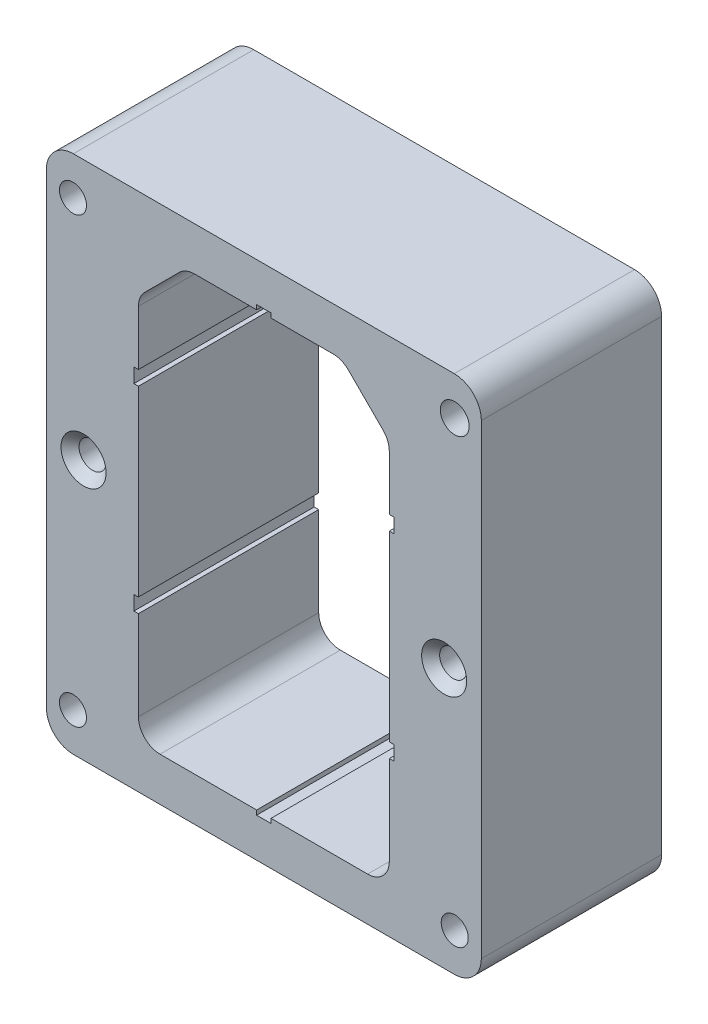
from build123d import *

# Parameters (mm, degrees)
SZKIC1_R                    = 1.5
SZKIC1_R_2                  = 1.6
DODANIE_WYCI_GNI_CIE1_DEPTH = 20
ZAOKR_GLENIE1_R             = 3
SFAZOWANIE1_SIZE            = 1
SZKIC2_R                    = 1.5
SZKIC2_R_2                  = 1.6
DODANIE_WYCI_GNI_CIE2_DEPTH = 0.2


with BuildPart() as part:
    # Szkic1 → Dodanie-wyciągnięcie1 (new body)
    with BuildSketch(Plane.XY):
        Polygon((-39.009773604, 35.733555733), (-39.009773604, 39.983555733), (9.235464557, 39.983555733), (9.235464557, 35.733555733), (9.235464557, -13.466444267), (9.235464557, -17.716444267), (-39.009773604, -17.716444267), (-39.009773604, -13.466444267), align=None)
        with Locations((5.112845476, 11.133555733)):
            Circle(SZKIC1_R, mode=Mode.SUBTRACT)
        with Locations((-34.887154524, 11.133555733)):
            Circle(SZKIC1_R, mode=Mode.SUBTRACT)
        with Locations((6.285464557, -13.466444267)):
            Circle(SZKIC1_R, mode=Mode.SUBTRACT)
        with Locations((6.285464557, 35.733555733)):
            Circle(SZKIC1_R_2, mode=Mode.SUBTRACT)
        with Locations((-36.059773604, 35.733555733)):
            Circle(SZKIC1_R, mode=Mode.SUBTRACT)
        with Locations((-36.059773604, -13.466444267)):
            Circle(SZKIC1_R, mode=Mode.SUBTRACT)
        with BuildLine():
            Line((-14.087154524, -13.391444267), (-14.087154524, -12.891444267))
            Line((-14.087154524, -12.891444267), (-3.372154524, -12.891444267))
            ThreePointArc((-3.372154524, -12.891444267), (-1.675098249, -12.188500541), (-0.972154524, -10.491444267))
            Line((-0.972154524, -10.491444267), (-0.972154524, -0.591444267))
            Line((-0.972154524, -0.591444267), (-0.472154524, -0.591444267))
            Line((-0.472154524, -0.591444267), (-0.472154524, 1.008555733))
            Line((-0.472154524, 1.008555733), (-0.972154524, 1.008555733))
            Line((-0.972154524, 1.008555733), (-0.972154524, 21.258555733))
            Line((-0.972154524, 21.258555733), (-0.472154524, 21.258555733))
            Line((-0.472154524, 21.258555733), (-0.472154524, 22.858555733))
            Line((-0.472154524, 22.858555733), (-0.972154524, 22.858555733))
            Line((-0.972154524, 22.858555733), (-0.972154524, 28.930128609))
            ThreePointArc((-0.972154524, 28.930128609), (-1.154843646, 29.848568846), (-1.675098249, 30.627184884))
            Line((-1.675098249, 30.627184884), (-5.503525374, 34.455612008))
            ThreePointArc((-5.503525374, 34.455612008), (-6.282141411, 34.975866612), (-7.200581648, 35.158555733))
            Line((-7.200581648, 35.158555733), (-14.087154524, 35.158555733))
            Line((-14.087154524, 35.158555733), (-14.087154524, 35.658555733))
            Line((-14.087154524, 35.658555733), (-15.687154524, 35.658555733))
            Line((-15.687154524, 35.658555733), (-15.687154524, 35.158555733))
            Line((-15.687154524, 35.158555733), (-22.573727399, 35.158555733))
            ThreePointArc((-22.573727399, 35.158555733), (-23.492167637, 34.975866612), (-24.270783674, 34.455612008))
            Line((-24.270783674, 34.455612008), (-28.099210798, 30.627184884))
            ThreePointArc((-28.099210798, 30.627184884), (-28.619465402, 29.848568846), (-28.802154524, 28.930128609))
            Line((-28.802154524, 28.930128609), (-28.802154524, 22.858555733))
            Line((-28.802154524, 22.858555733), (-29.302154524, 22.858555733))
            Line((-29.302154524, 22.858555733), (-29.302154524, 21.258555733))
            Line((-29.302154524, 21.258555733), (-28.802154524, 21.258555733))
            Line((-28.802154524, 21.258555733), (-28.802154524, 1.008555733))
            Line((-28.802154524, 1.008555733), (-29.302154524, 1.008555733))
            Line((-29.302154524, 1.008555733), (-29.302154524, -0.591444267))
            Line((-29.302154524, -0.591444267), (-28.802154524, -0.591444267))
            Line((-28.802154524, -0.591444267), (-28.802154524, -10.491444267))
            ThreePointArc((-28.802154524, -10.491444267), (-28.099210798, -12.188500541), (-26.402154524, -12.891444267))
            Line((-26.402154524, -12.891444267), (-15.687154524, -12.891444267))
            Line((-15.687154524, -12.891444267), (-15.687154524, -13.391444267))
            Line((-15.687154524, -13.391444267), (-14.087154524, -13.391444267))
        make_face(mode=Mode.SUBTRACT)
    extrude(amount=DODANIE_WYCI_GNI_CIE1_DEPTH)

    # Zaokrąglenie1
    zaokr_glenie1_edges = [part.edges().sort_by_distance(p)[0] for p in [
        (-39.009773604, 39.983555733, 10),
        (9.235464557, 39.983555733, 10),
        (9.235464557, -17.716444267, 10),
        (-39.009773604, -17.716444267, 10),
    ]]
    fillet(zaokr_glenie1_edges, radius=ZAOKR_GLENIE1_R)

    # Sfazowanie1
    sfazowanie1_edges = [part.edges().sort_by_distance(p)[0] for p in [
        (3.612845476, 11.133555733, 20),
        (-36.387154524, 11.133555733, 20),
    ]]
    chamfer(sfazowanie1_edges, length=SFAZOWANIE1_SIZE)

    # Szkic2 → Dodanie-wyciągnięcie2 (add)
    with BuildSketch(Plane(origin=(0, 0, 0), x_dir=(-1, 0, 0), z_dir=(0, 0, -1))):
        with Locations((36.059773604, 35.733555733)):
            Circle(SZKIC2_R)
        with Locations((34.887154524, 11.133555733)):
            Circle(SZKIC2_R)
        with Locations((36.059773604, -13.466444267)):
            Circle(SZKIC2_R)
        with Locations((-6.285464557, 35.733555733)):
            Circle(SZKIC2_R_2)
        with Locations((-5.112845476, 11.133555733)):
            Circle(SZKIC2_R)
        with Locations((-6.285464557, -13.466444267)):
            Circle(SZKIC2_R)
    extrude(amount=-DODANIE_WYCI_GNI_CIE2_DEPTH)


solid = part.part
